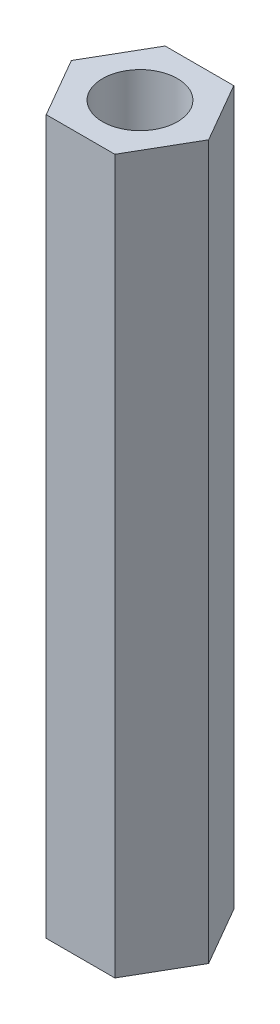
from build123d import *

# Parameters (mm, degrees)
EXTRUDE_1_DEPTH       = 30
HOLE_WIZARD_M35_D     = 3.15
HOLE_WIZARD_M35_DEPTH = 8
HOLE_WIZARD_M35_TIP   = 0.946355475
HOLE_WIZARD_M36_D     = 3.15
HOLE_WIZARD_M36_DEPTH = 8
HOLE_WIZARD_M36_TIP   = 0.946355475


with BuildPart() as part:
    # Эскиз1 → Бобышка-Вытянуть1 (new body)
    with BuildSketch(Plane(origin=(0, 0, 0), x_dir=(1, 0, 0), z_dir=(0, 1, 0))):
        Polygon((2.886751346, 0), (1.443375673, 2.5), (-1.443375673, 2.5), (-2.886751346, 0), (-1.443375673, -2.5), (1.443375673, -2.5), align=None)
    extrude(amount=EXTRUDE_1_DEPTH)

    # Сверло под метчик  спиральное M35
    with Locations(Plane(origin=(0, 30, 0), x_dir=(1, 0, 0), z_dir=(0, 1, 0))):
        with Locations((0, 0)):
            Hole(HOLE_WIZARD_M35_D / 2, depth=HOLE_WIZARD_M35_DEPTH)
            with Locations((0, 0, -(HOLE_WIZARD_M35_DEPTH + HOLE_WIZARD_M35_TIP / 2))):  # 118° drill point
                Cone(0, HOLE_WIZARD_M35_D / 2, HOLE_WIZARD_M35_TIP, mode=Mode.SUBTRACT)

    # Сверло под метчик  спиральное M36
    with Locations(Plane(origin=(0, 0, 0), x_dir=(-1, 0, 0), z_dir=(0, -1, 0))):
        with Locations((0, 0)):
            Hole(HOLE_WIZARD_M36_D / 2, depth=HOLE_WIZARD_M36_DEPTH)
            with Locations((0, 0, -(HOLE_WIZARD_M36_DEPTH + HOLE_WIZARD_M36_TIP / 2))):  # 118° drill point
                Cone(0, HOLE_WIZARD_M36_D / 2, HOLE_WIZARD_M36_TIP, mode=Mode.SUBTRACT)


solid = part.part
